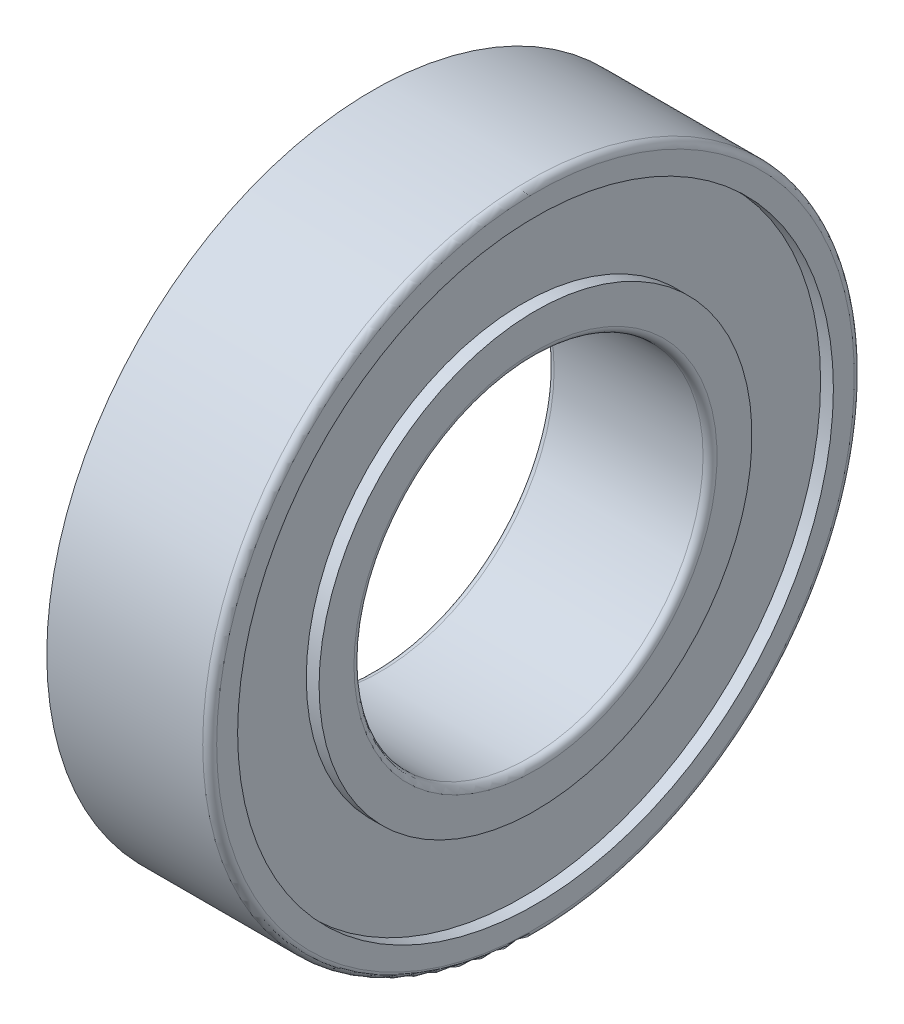
from build123d import *


with BuildPart() as part:
    # 草图1 → 旋转1 (revolve)
    with BuildSketch(Plane.XY):
        with BuildLine():
            Line((0, 14), (0, 12.8))
            Line((0, 12.8), (0.55, 12.8))
            Line((0.55, 12.8), (0.55, 9.3))
            Line((0.55, 9.3), (0, 9.3))
            Line((0, 9.3), (0, 7.8))
            ThreePointArc((0, 7.8), (0.087867966, 7.587867966), (0.3, 7.5))
            Line((0.3, 7.5), (6.7, 7.5))
            ThreePointArc((6.7, 7.5), (6.912132034, 7.587867966), (7, 7.8))
            Line((7, 7.8), (7, 9.3))
            Line((7, 9.3), (6.45, 9.3))
            Line((6.45, 9.3), (6.45, 12.8))
            Line((6.45, 12.8), (7, 12.8))
            Line((7, 12.8), (7, 13.7))
            ThreePointArc((7, 13.7), (6.912132034, 13.912132034), (6.7, 14))
            Line((6.7, 14), (0, 14))
        make_face()
    revolve(axis=Axis((7, 0, 0), (-1, 0, 0)))


solid = part.part
